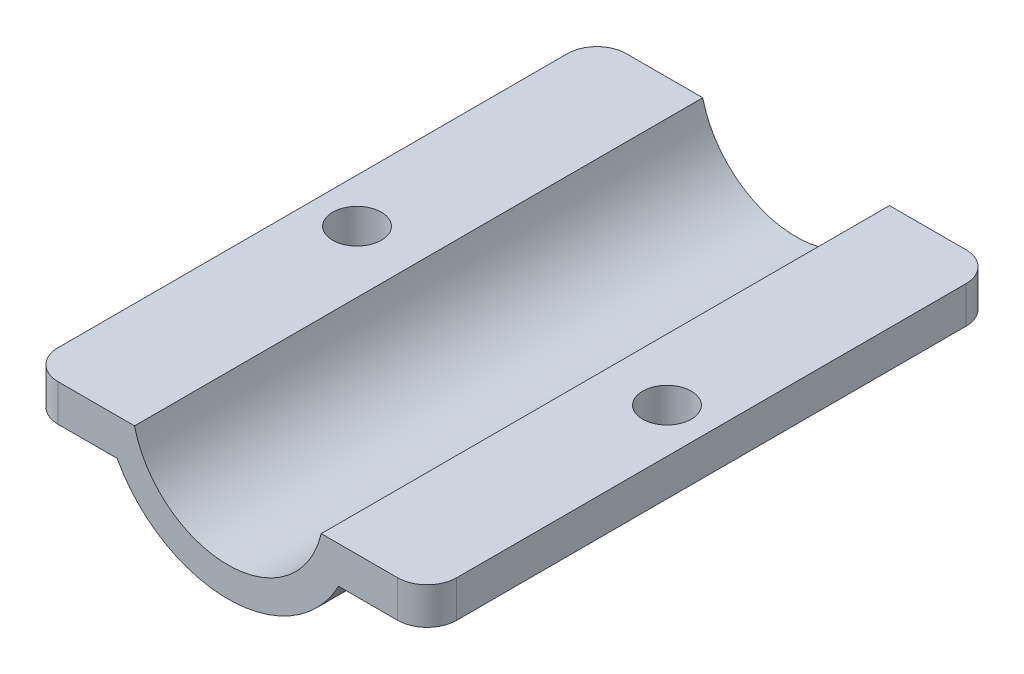
from build123d import *

# Parameters (mm, degrees)
EXTRUDE_1_DEPTH     = 38.5
SKETCH_2_R          = 1.65
CUT_EXTRUDE_1_DEPTH = 42.045706231
FILLET_1_R          = 2


with BuildPart() as part:
    # 草图1 → 凸台-拉伸1 (new body)
    with BuildSketch(Plane.XY):
        with BuildLine():
            Line((-6.32455532, -1.5), (-13.5, -1.5))
            Line((-13.5, -1.5), (-13.5, -4))
            Line((-13.5, -4), (-7.5, -4))
            ThreePointArc((-7.5, -4), (0, -8.5), (7.5, -4))
            Line((7.5, -4), (13.5, -4))
            Line((13.5, -4), (13.5, -1.5))
            Line((13.5, -1.5), (6.32455532, -1.5))
            ThreePointArc((6.32455532, -1.5), (0, -6.5), (-6.32455532, -1.5))
        make_face()
    extrude(amount=EXTRUDE_1_DEPTH)

    # 草图2 → 切除-拉伸1 (cut, through all)
    with BuildSketch(Plane.XZ.offset(4)):
        with Locations(Location((-10.5, 19.25, 0), (0, 0, 270))):
            Circle(SKETCH_2_R)
        with Locations(Location((10.5, 19.25, 0), (0, 0, 270))):
            Circle(SKETCH_2_R)
    extrude(amount=-CUT_EXTRUDE_1_DEPTH, mode=Mode.SUBTRACT)

    # 圆角1
    fillet_1_edges = [part.edges().sort_by_distance(p)[0] for p in [
        (-13.5, -2.75, 38.5),
        (13.5, -2.75, 38.5),
        (13.5, -2.75, 0),
        (-13.5, -2.75, 0),
    ]]
    fillet(fillet_1_edges, radius=FILLET_1_R)


solid = part.part
